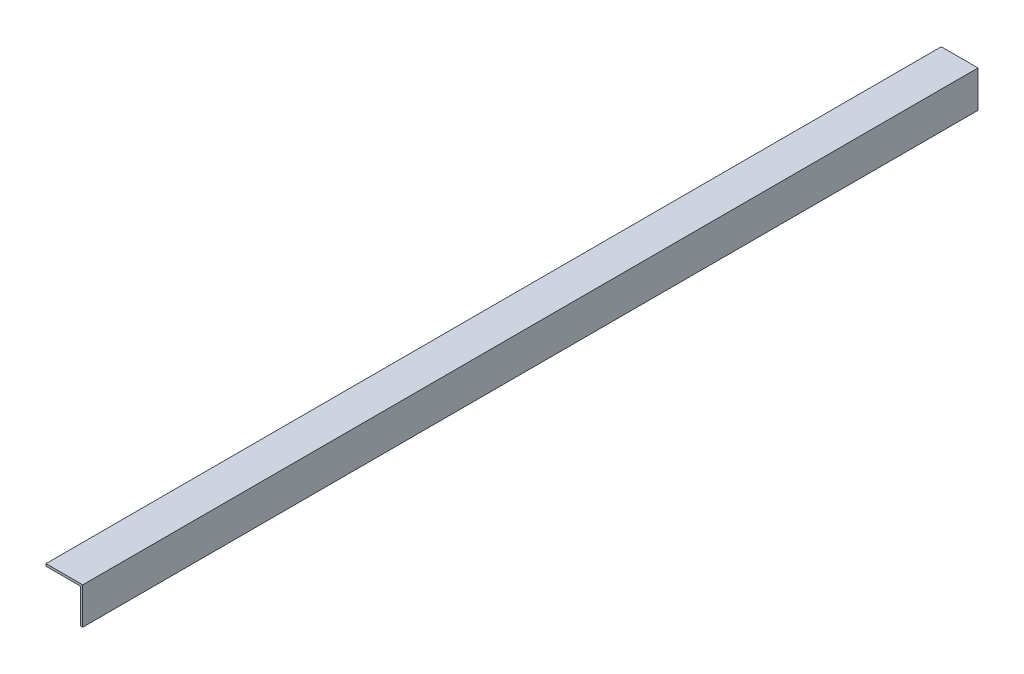
from build123d import *

# Parameters (mm, degrees)
PRESS_UC_RAFI_KOSEBENT_SAG_1_START = -20
PRESS_UC_RAFI_KOSEBENT_SAG_1_DEPTH = 780


with BuildPart() as part:
    # Sketch1 → PRESS_uc_rafi_kosebent_sag_1 (new body)
    with BuildSketch(Plane.XY.offset(PRESS_UC_RAFI_KOSEBENT_SAG_1_START)):
        Polygon((662, 1122), (660, 1122), (660, 1152), (630, 1152), (630, 1154), (662, 1154), align=None)
    extrude(amount=-PRESS_UC_RAFI_KOSEBENT_SAG_1_DEPTH)


solid = part.part
